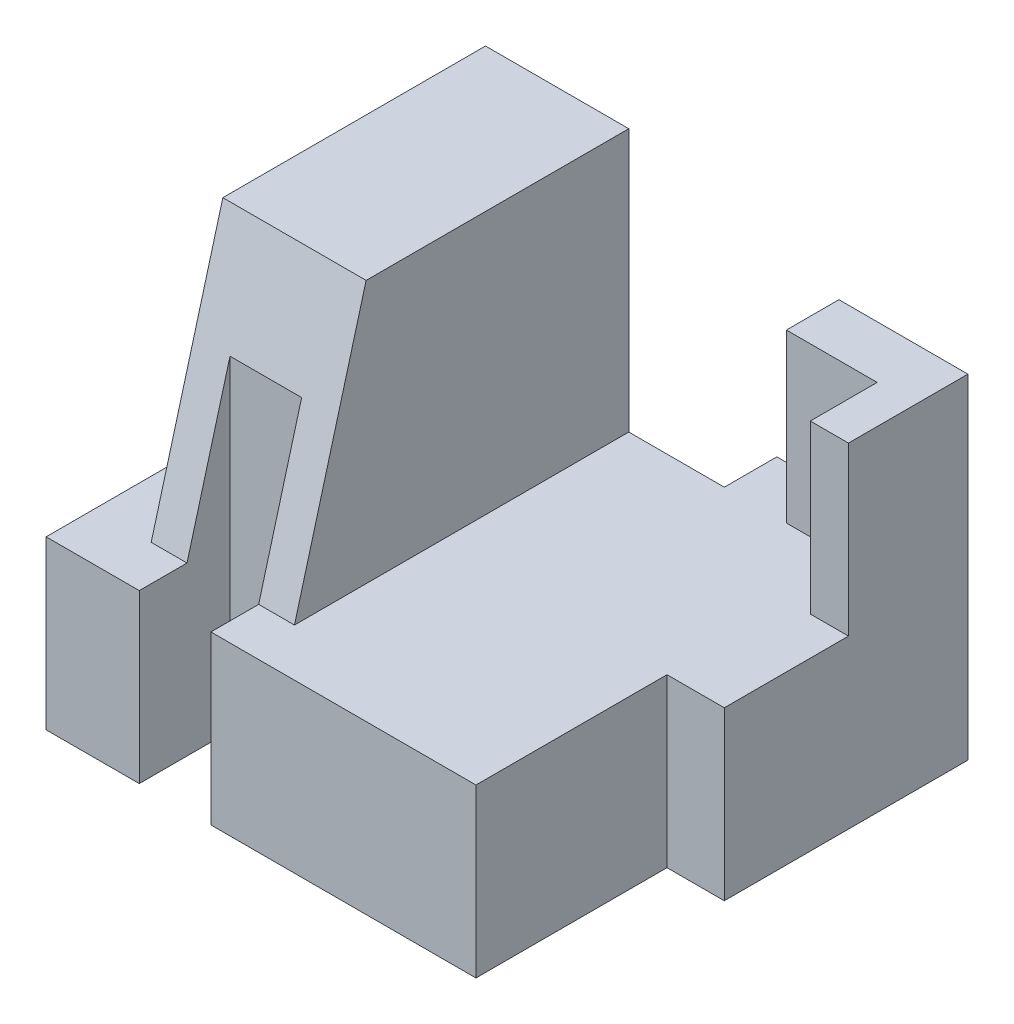
from build123d import *

# Parameters (mm, degrees)
EXTRUDE_1_DEPTH     = 80
EXTRUDE_START       = -12
EXTRUDE_2_DEPTH     = 30
SKETCH_3_W          = 15
SKETCH_3_H          = 19
CUT_EXTRUDE_1_DEPTH = 129.549601322
SKETCH_4_W          = 12
SKETCH_4_H          = 26
SKETCH_4_W_2        = 13
SKETCH_4_H_2        = 11
EXTRUDE_3_DEPTH     = 35
EXTRUDE_4_DEPTH     = 35
SKETCH_5_W          = 4
SKETCH_5_H          = 14
CUT_EXTRUDE_2_DEPTH = 35
EXTRUDE_5_DEPTH     = 40


with BuildPart() as part:
    # Эскиз1 → Бобышка-Вытянуть1 (new body)
    with BuildSketch(Plane.XY):
        Polygon((-45, -17.5), (30, -17.5), (45, 17.5), (-45, 17.5), align=None)
    extrude(amount=EXTRUDE_1_DEPTH)

    # Эскиз2 → Бобышка-Вытянуть2 (add)
    with BuildSketch(Plane.ZY.offset(45).offset(EXTRUDE_START)):
        Polygon((0, 17.5), (0, 72.5), (55, 72.5), (70, 17.5), align=None)
    extrude(amount=-EXTRUDE_2_DEPTH)

    # Эскиз3 → Вырез-Вытянуть1 (cut, through all)
    with BuildSketch(Plane(origin=(0, 72.5, 0), x_dir=(1, 0, 0), z_dir=(0, 1, 0))):
        with Locations((-18, -70.5)):
            Rectangle(SKETCH_3_W, SKETCH_3_H)
    extrude(amount=-CUT_EXTRUDE_1_DEPTH, mode=Mode.SUBTRACT)

    # Эскиз4 → Бобышка-Вытянуть3 (add)
    with BuildSketch(Plane(origin=(0, 17.5, 0), x_dir=(1, 0, 0), z_dir=(0, 1, 0))):
        Polygon((17, 0), (17, -40), (45, -40), (45, -14), (45, 0), (30, 0), align=None)
        with Locations((51, -27)):
            Rectangle(SKETCH_4_W, SKETCH_4_H)
        Polygon((45, 0), (45, -14), (57, -14), (57, 11), (30, 11), (30, 0), align=None)
        with Locations((23.5, 5.5)):
            Rectangle(SKETCH_4_W_2, SKETCH_4_H_2)
    extrude(amount=-EXTRUDE_3_DEPTH)

    # Эскиз4<3> → Бобышка-Вытянуть4 (add)
    with BuildSketch(Plane(origin=(0, 17.5, 0), x_dir=(1, 0, 0), z_dir=(0, 1, 0))):
        Polygon((45, 0), (45, -14), (57, -14), (57, 11), (30, 11), (30, 0), align=None)
    extrude(amount=EXTRUDE_4_DEPTH)

    # Эскиз5 → Вырез-Вытянуть2 (cut)
    with BuildSketch(Plane(origin=(0, 52.5, 0), x_dir=(1, 0, 0), z_dir=(0, 1, 0))):
        with Locations((47, -7)):
            Rectangle(SKETCH_5_W, SKETCH_5_H)
    extrude(amount=-CUT_EXTRUDE_2_DEPTH, mode=Mode.SUBTRACT)

    # Эскиз6 → Бобышка-Вытянуть5 (add)
    with BuildSketch(Plane.XY.offset(80)):
        Polygon((30, -17.5), (45, 17.5), (45, -17.5), align=None)
    extrude(amount=-EXTRUDE_5_DEPTH)


solid = part.part
